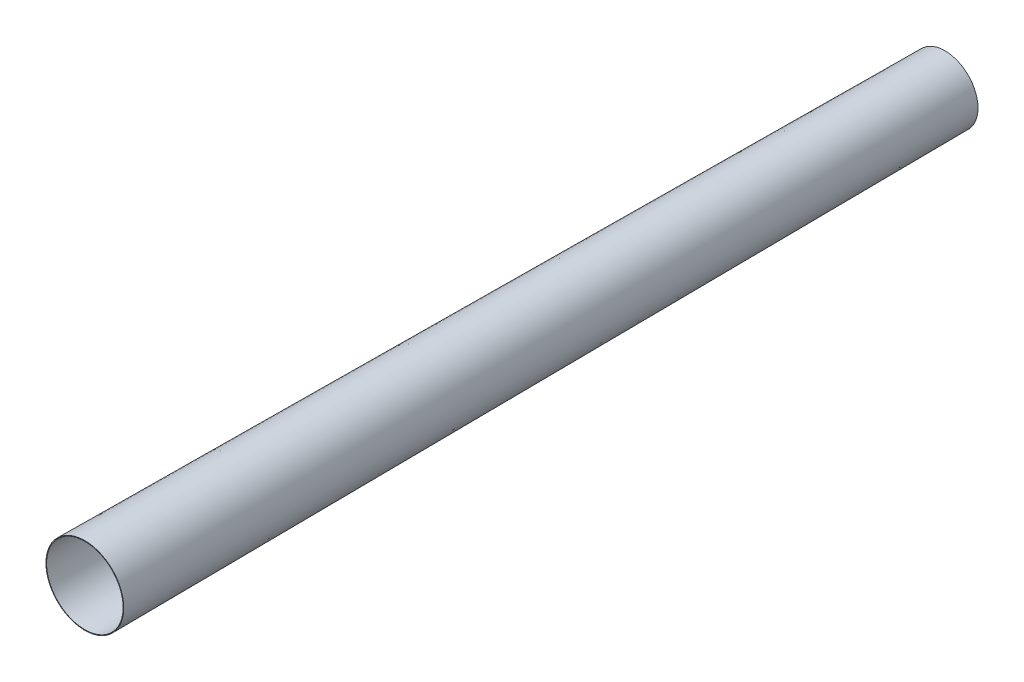
from build123d import *

# Parameters (mm, degrees)
SKETCH1_R = 26.937422296
SKETCH2_R = 31.703273933
SHELL1_T  = -0.5


with BuildPart() as part:
    # Sketch1 → Loft1 section 0
    with BuildSketch(Plane.XY):
        Circle(SKETCH1_R)
    # Sketch2 → Loft1 section 1
    with BuildSketch(Plane.XY.offset(700.99461252)):
        Circle(SKETCH2_R)
    loft()

    # Shell1
    shell1_openings = [part.faces().sort_by_distance(p)[0] for p in [
        (0, 0, 700.99461252),
        (0, 0, 0),
    ]]
    offset(amount=SHELL1_T, openings=shell1_openings, kind=Kind.INTERSECTION)


solid = part.part
